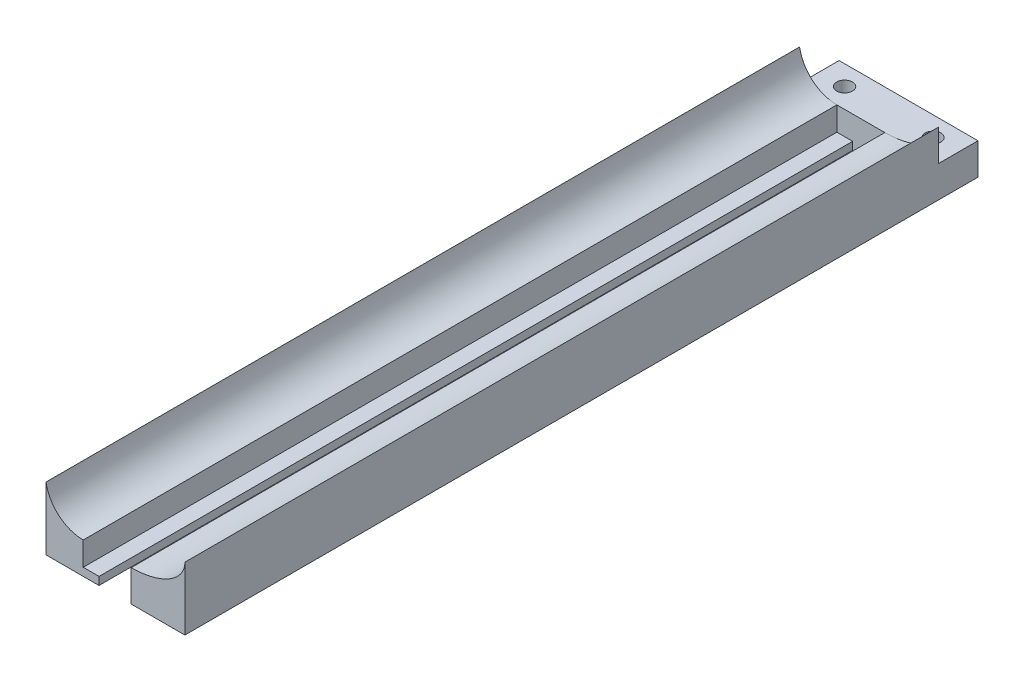
from build123d import *

# Parameters (mm, degrees)
SKETCH1_W           = 27.94
SKETCH1_H           = 6.35
BOSS_EXTRUDE1_DEPTH = 7.9502
SKETCH2_W           = 10.795
SKETCH2_H           = 6.35
BOSS_EXTRUDE2_DEPTH = 151.60625
SKETCH4_R           = 1.5875
CUT_EXTRUDE1_DEPTH  = 161.292682729
BOSS_EXTRUDE3_DEPTH = 151.60625


with BuildPart() as part:
    # Sketch1 → Boss-Extrude1 (new body)
    with BuildSketch(Plane.XY):
        Rectangle(SKETCH1_W, SKETCH1_H)
    extrude(amount=BOSS_EXTRUDE1_DEPTH)

    # Sketch2 → Boss-Extrude2 (add)
    with BuildSketch(Plane.XY.offset(7.9502)):
        Polygon((-3.302, -3.175), (-3.302, -1.5875), (-6.477, -1.5875), (-6.477, 3.175), (-13.97, 3.175), (-13.97, -3.175), align=None)
        with Locations((8.5725, 0)):
            Rectangle(SKETCH2_W, SKETCH2_H)
    extrude(amount=BOSS_EXTRUDE2_DEPTH)

    # Sketch4 → Cut-Extrude1 (cut, through all)
    with BuildSketch(Plane(origin=(0, 3.175, 0), x_dir=(1, 0, 0), z_dir=(0, 1, 0))):
        with Locations(Location((-8.89, -3.9751, 0), (0, 0, 270))):
            Circle(SKETCH4_R)
        with Locations(Location((8.89, -3.9751, 0), (0, 0, 270))):
            Circle(SKETCH4_R)
    extrude(amount=-CUT_EXTRUDE1_DEPTH, mode=Mode.SUBTRACT)

    # Sketch5 → Boss-Extrude3 (add)
    with BuildSketch(Plane.XY.offset(159.55645)):
        with BuildLine():
            Line((-13.97, 3.175), (-13.97, 9.525))
            ThreePointArc((-13.97, 9.525), (-11.38789475, 4.976014194), (-6.477, 3.175))
            Line((-6.477, 3.175), (-13.97, 3.175))
        make_face()
        with BuildLine():
            Line((3.175, 3.175), (13.97, 3.175))
            Line((13.97, 3.175), (13.97, 9.525))
            add(Edge.make_bspline(
                [(3.175, 3.175), (13.97, 3.175), (13.97, 9.525)],
                knots=[4.71238898, 4.71238898, 4.71238898, 6.283185307, 6.283185307, 6.283185307], degree=2, weights=[1, 0.707106781, 1]))
        make_face()
    extrude(amount=-BOSS_EXTRUDE3_DEPTH)


solid = part.part
